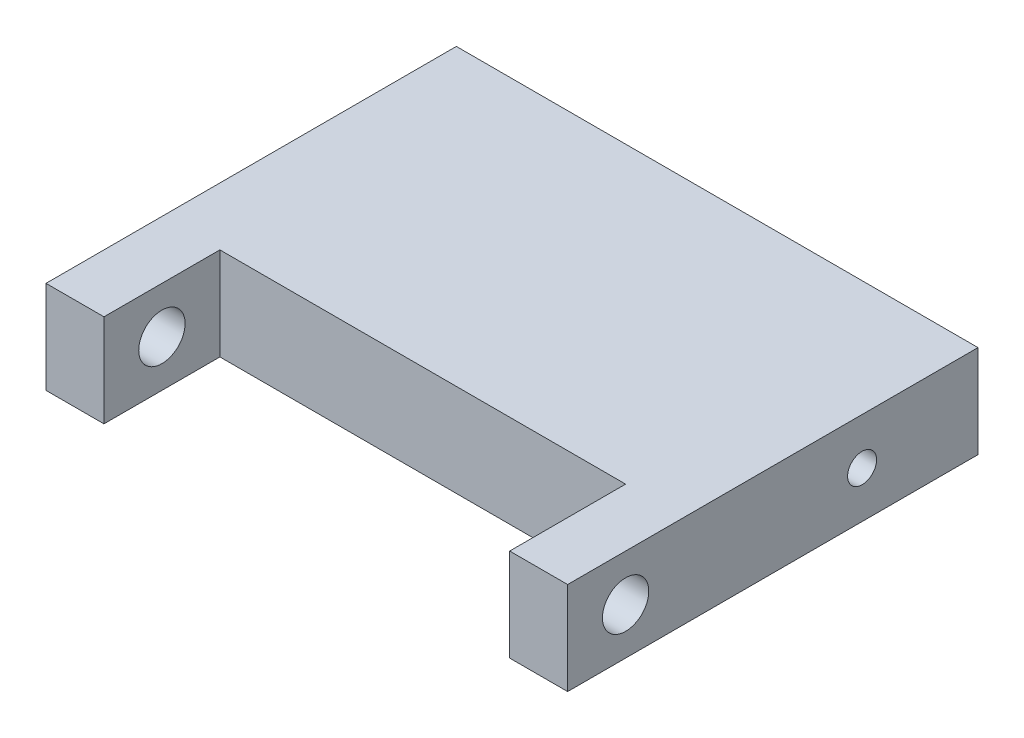
from build123d import *

# Parameters (mm, degrees)
SKETCH1_W           = 45
SKETCH1_H           = 25.4
BOSS_EXTRUDE1_DEPTH = 8
SKETCH2_W           = 5
SKETCH2_H           = 8
BOSS_EXTRUDE2_DEPTH = 10
SKETCH3_R           = 2
CUT_EXTRUDE1_DEPTH  = 30
LPATTERN1_COUNT     = 2
LPATTERN1_PITCH     = 40
SKETCH4_R           = 1.25
CUT_EXTRUDE2_DEPTH  = 8
LPATTERN2_COUNT     = 2
LPATTERN2_PITCH     = 37


with BuildPart() as part:
    # Sketch1 → Boss-Extrude1 (new body)
    with BuildSketch(Plane(origin=(0, 0, 0), x_dir=(1, 0, 0), z_dir=(0, 1, 0))):
        with Locations((22.5, 12.7)):
            Rectangle(SKETCH1_W, SKETCH1_H)
    extrude(amount=BOSS_EXTRUDE1_DEPTH)

    # Sketch2 → Boss-Extrude2 (add)
    with BuildSketch(Plane.XY):
        with Locations((42.5, 4)):
            Rectangle(SKETCH2_W, SKETCH2_H)
    boss_extrude2 = extrude(amount=BOSS_EXTRUDE2_DEPTH)

    # Sketch3 → Cut-Extrude1 (cut)
    with BuildSketch(Plane.ZY.offset(-40)):
        with Locations((5, 4)):
            Circle(SKETCH3_R)
    cut_extrude1 = extrude(amount=-CUT_EXTRUDE1_DEPTH, mode=Mode.SUBTRACT)

    # LPattern1: Boss-Extrude2, Cut-Extrude1 ×2
    with Locations(*[(-i * LPATTERN1_PITCH, 0, 0) for i in range(1, LPATTERN1_COUNT)]):
        add(boss_extrude2)
        add(cut_extrude1, mode=Mode.SUBTRACT)

    # Sketch4 → Cut-Extrude2 (cut)
    with BuildSketch(Plane.ZY):
        with Locations((-15.4, 4)):
            Circle(SKETCH4_R)
    cut_extrude2 = extrude(amount=-CUT_EXTRUDE2_DEPTH, mode=Mode.SUBTRACT)

    # LPattern2: Cut-Extrude2 ×2
    with Locations(*[(i * LPATTERN2_PITCH, 0, 0) for i in range(1, LPATTERN2_COUNT)]):
        add(cut_extrude2, mode=Mode.SUBTRACT)


solid = part.part
